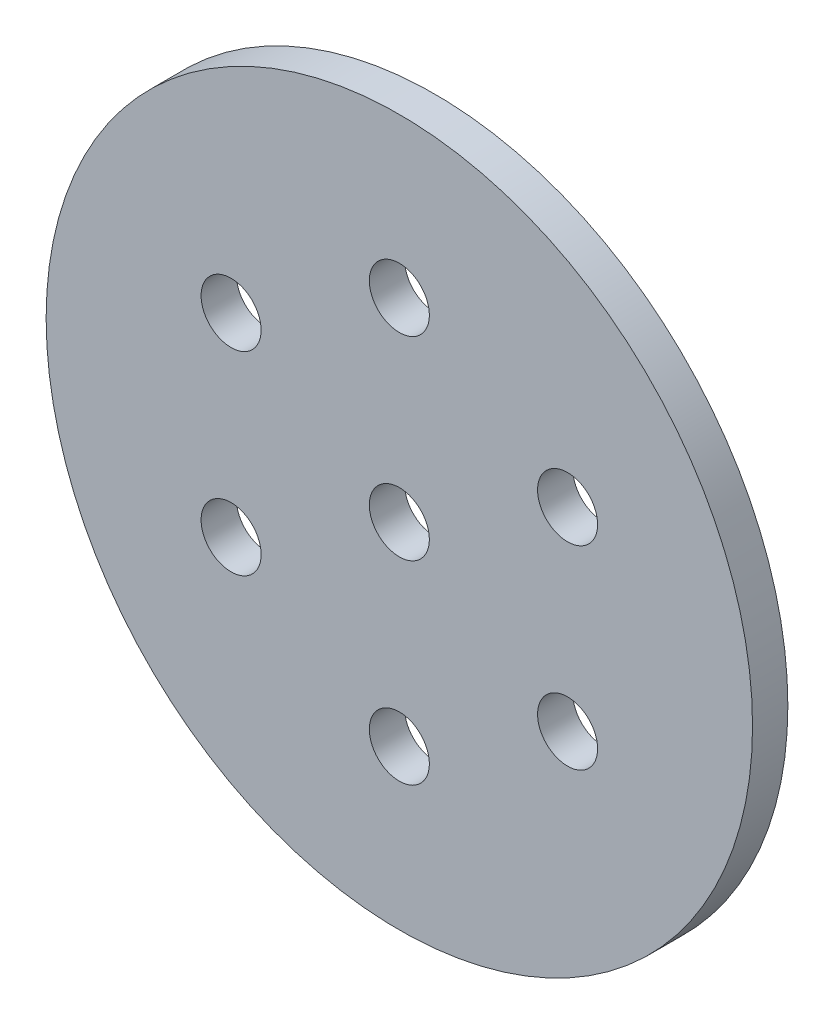
from build123d import *

# Parameters (mm, degrees)
SKETCH1_R           = 100
SKETCH1_R_2         = 8.5
BOSS_EXTRUDE1_DEPTH = 10


with BuildPart() as part:
    # Sketch1 → Boss-Extrude1 (new body)
    with BuildSketch(Plane.XY):
        Circle(SKETCH1_R)
        Circle(SKETCH1_R_2, mode=Mode.SUBTRACT)
        with Locations((0, 55)):
            Circle(SKETCH1_R_2, mode=Mode.SUBTRACT)
        with Locations((47.631397208, 27.5)):
            Circle(SKETCH1_R_2, mode=Mode.SUBTRACT)
        with Locations((47.631397208, -27.5)):
            Circle(SKETCH1_R_2, mode=Mode.SUBTRACT)
        with Locations((0, -55)):
            Circle(SKETCH1_R_2, mode=Mode.SUBTRACT)
        with Locations((-47.631397208, -27.5)):
            Circle(SKETCH1_R_2, mode=Mode.SUBTRACT)
        with Locations((-47.631397208, 27.5)):
            Circle(SKETCH1_R_2, mode=Mode.SUBTRACT)
    extrude(amount=BOSS_EXTRUDE1_DEPTH)


solid = part.part
